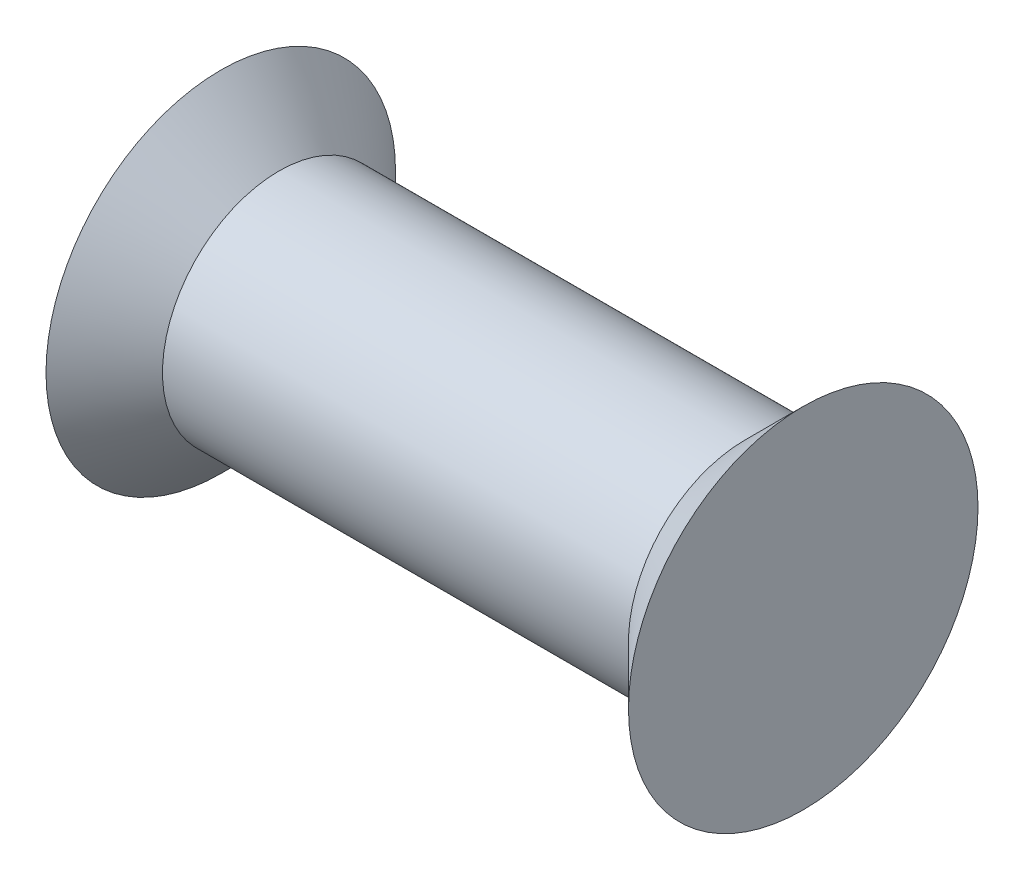
from build123d import *

# Parameters (mm, degrees)
SKETCH_1_W = 2
SKETCH_1_H = 1


with BuildPart() as part:
    # 草图1 → 旋转1 (revolve)
    with BuildSketch(Plane.XY, mode=Mode.PRIVATE) as revolve_1_sk:
        with Locations((1, 0.5)):
            Rectangle(SKETCH_1_W, SKETCH_1_H)
        Polygon((2.5, 0), (2, 0), (2, 1), (2.5, 1.5), align=None)
    revolve_1 = revolve(revolve_1_sk.sketch.rotate(Axis((0, 0, 0), (1, 0, 0)), 180), axis=Axis((0, 0, 0), (1, 0, 0)))

    # 镜向1: 旋转1 across plane
    add(revolve_1.mirror(Plane.ZY))


solid = part.part
